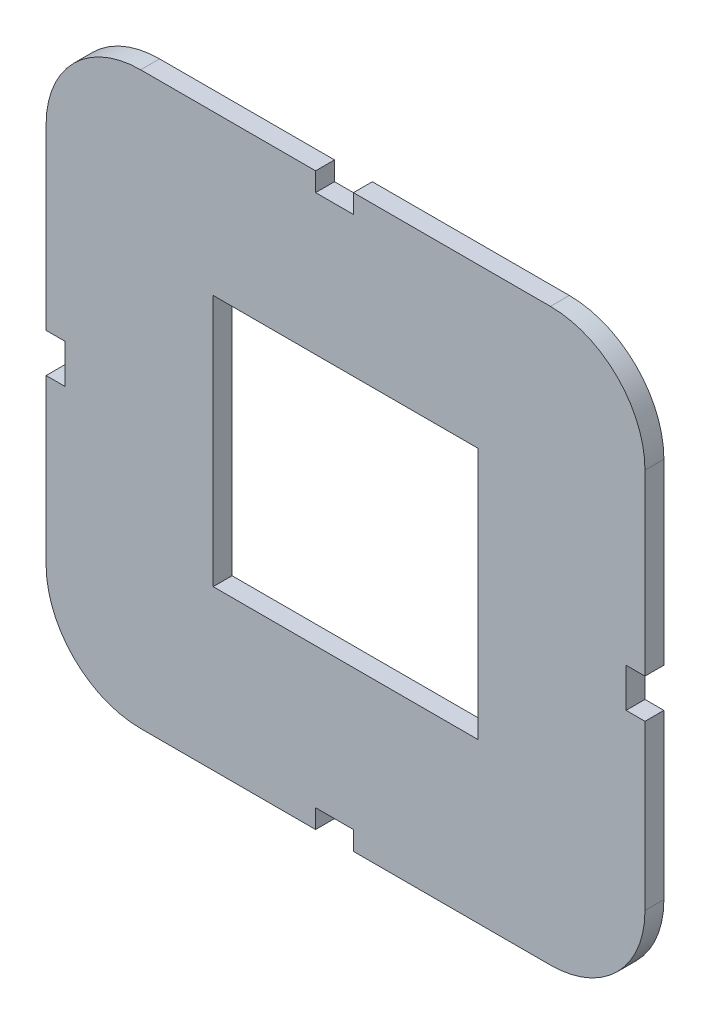
from build123d import *

# Parameters (mm, degrees)
SKETCH1_W           = 42
SKETCH1_H           = 40.010526316
BOSS_EXTRUDE1_DEPTH = 3


with BuildPart() as part:
    # Sketch1 → Boss-Extrude1 (new body)
    with BuildSketch(Plane.XY):
        with BuildLine():
            Line((-47.5, -4.25), (-44.5, -4.25))
            Line((-44.5, -4.25), (-44.5, 1.95))
            Line((-44.5, 1.95), (-47.5, 1.95))
            Line((-47.5, 1.95), (-47.5, 30.25))
            ThreePointArc((-47.5, 30.25), (-43.106601718, 40.856601718), (-32.5, 45.25))
            Line((-32.5, 45.25), (-4.75, 45.25))
            Line((-4.75, 45.25), (-4.75, 42.25))
            Line((-4.75, 42.25), (1.25, 42.25))
            Line((1.25, 42.25), (1.25, 45.25))
            Line((1.25, 45.25), (32.5, 45.25))
            ThreePointArc((32.5, 45.25), (43.106601718, 40.856601718), (47.5, 30.25))
            Line((47.5, 30.25), (47.5, 1.95))
            Line((47.5, 1.95), (44.5, 1.95))
            Line((44.5, 1.95), (44.5, -4.25))
            Line((44.5, -4.25), (47.5, -4.25))
            Line((47.5, -4.25), (47.5, -30.25))
            ThreePointArc((47.5, -30.25), (43.106601718, -40.856601718), (32.5, -45.25))
            Line((32.5, -45.25), (1.25, -45.25))
            Line((1.25, -45.25), (1.25, -42.25))
            Line((1.25, -42.25), (-4.75, -42.25))
            Line((-4.75, -42.25), (-4.75, -45.25))
            Line((-4.75, -45.25), (-32.5, -45.25))
            ThreePointArc((-32.5, -45.25), (-43.106601718, -40.856601718), (-47.5, -30.25))
            Line((-47.5, -30.25), (-47.5, -4.25))
        make_face()
        Rectangle(SKETCH1_W, SKETCH1_H, mode=Mode.SUBTRACT)
    extrude(amount=BOSS_EXTRUDE1_DEPTH)


solid = part.part
